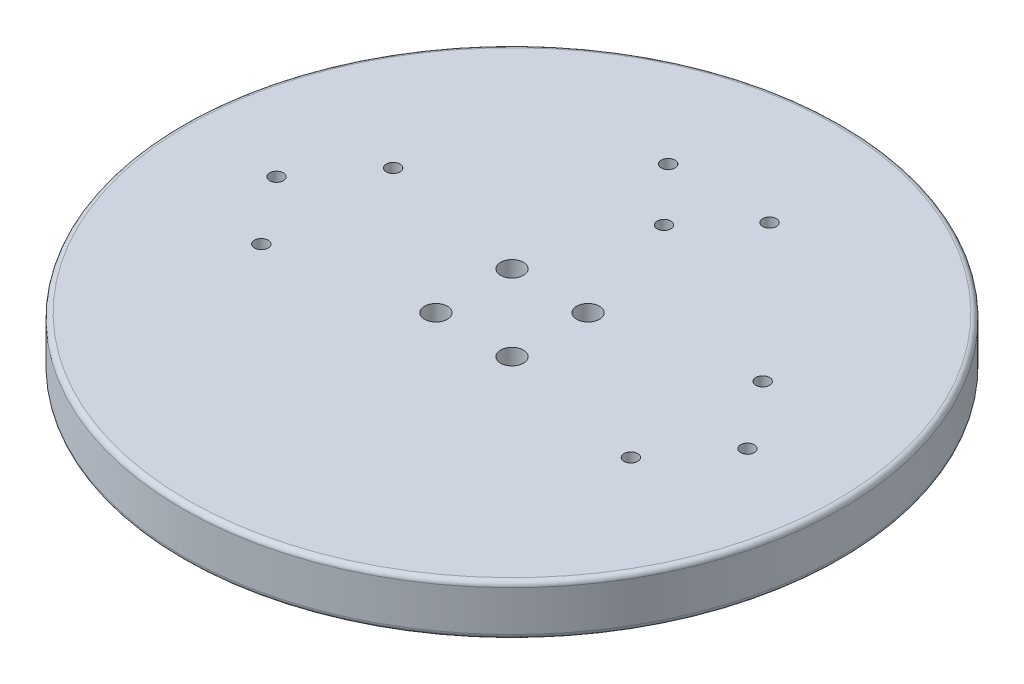
from build123d import *

# Parameters (mm, degrees)
SKETCH1_R             = 65
BOSS_EXTRUDE1_DEPTH   = 10
FILLET1_R             = 1
F_6_32_TAPPED_HOLE1_D = 2.7051
F_8_CLEARANCE_HOLE1_D = 4.4958


with BuildPart() as part:
    # Sketch1 → Boss-Extrude1 (new body)
    with BuildSketch(Plane(origin=(0, 0, 0), x_dir=(1, 0, 0), z_dir=(0, 1, 0))):
        with Locations(Location((0, 0, 0), (0, 0, 270))):
            Circle(SKETCH1_R)
    extrude(amount=BOSS_EXTRUDE1_DEPTH)

    # Fillet1
    fillet1_edges = [part.edges().sort_by_distance(p)[0] for p in [
        (0, 0, -65),
        (0, 10, -65),
    ]]
    fillet(fillet1_edges, radius=FILLET1_R)

    # #6-32 Tapped Hole1 (through all)
    with Locations(Plane.XZ):
        with Locations((-46.445, 0), (46.445, 0), (-36.445, -13), (-36.445, 13), (36.445, 13), (36.445, -13), (0, -29.98), (-10, -40.8), (10, -40.8)):
            Hole(F_6_32_TAPPED_HOLE1_D / 2)

    # #8 Clearance Hole1 (through all)
    with Locations(Plane(origin=(0, 0, 0), x_dir=(-1, 0, 0), z_dir=(0, -1, 0))):
        with Locations((7.5, -7.5), (-7.5, -7.5), (7.5, 7.5), (-7.5, 7.5)):
            Hole(F_8_CLEARANCE_HOLE1_D / 2)


solid = part.part
